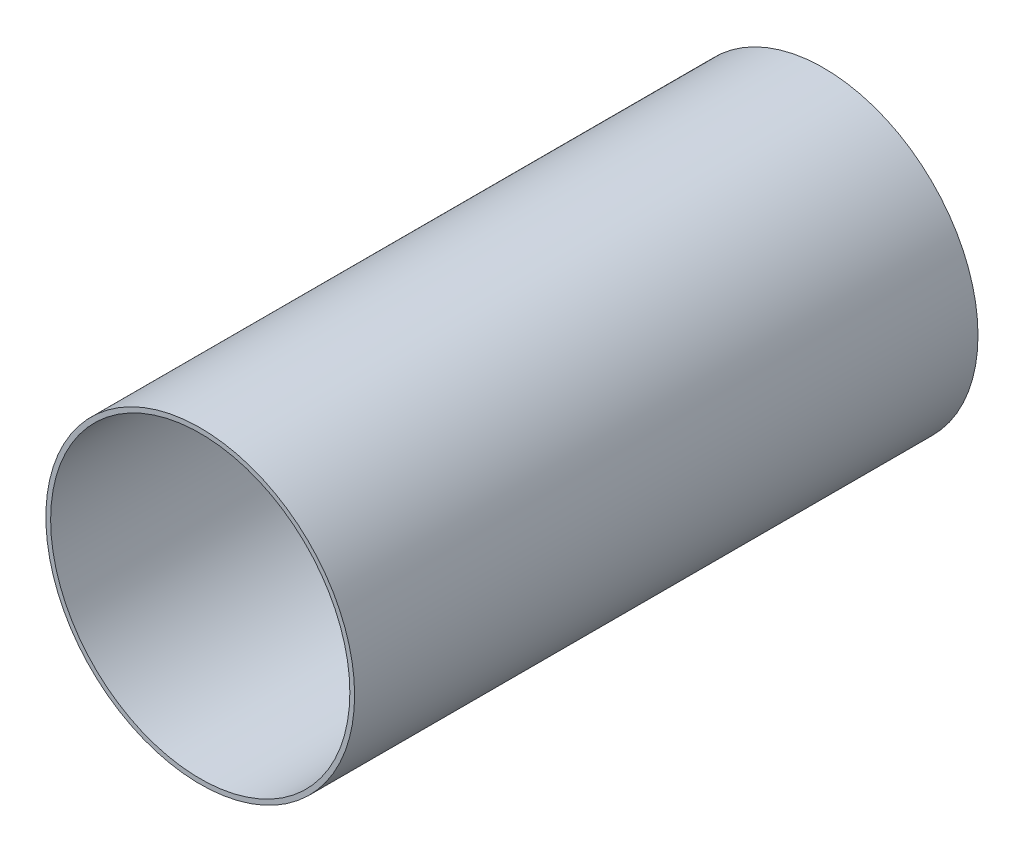
from build123d import *

# Parameters (mm, degrees)
SKETCH1_R           = 49.53
SKETCH1_R_2         = 48
BOSS_EXTRUDE1_DEPTH = 200


with BuildPart() as part:
    # Sketch1 → Boss-Extrude1 (new body)
    with BuildSketch(Plane(origin=(0, 0, 0), x_dir=(0, 1, 0), z_dir=(0, 0, 1))):
        with Locations(Location((0, 0, 0), (0, 0, 270))):
            Circle(SKETCH1_R)
        with Locations(Location((0, 0, 0), (0, 0, 270))):
            Circle(SKETCH1_R_2, mode=Mode.SUBTRACT)
    extrude(amount=BOSS_EXTRUDE1_DEPTH)


solid = part.part
